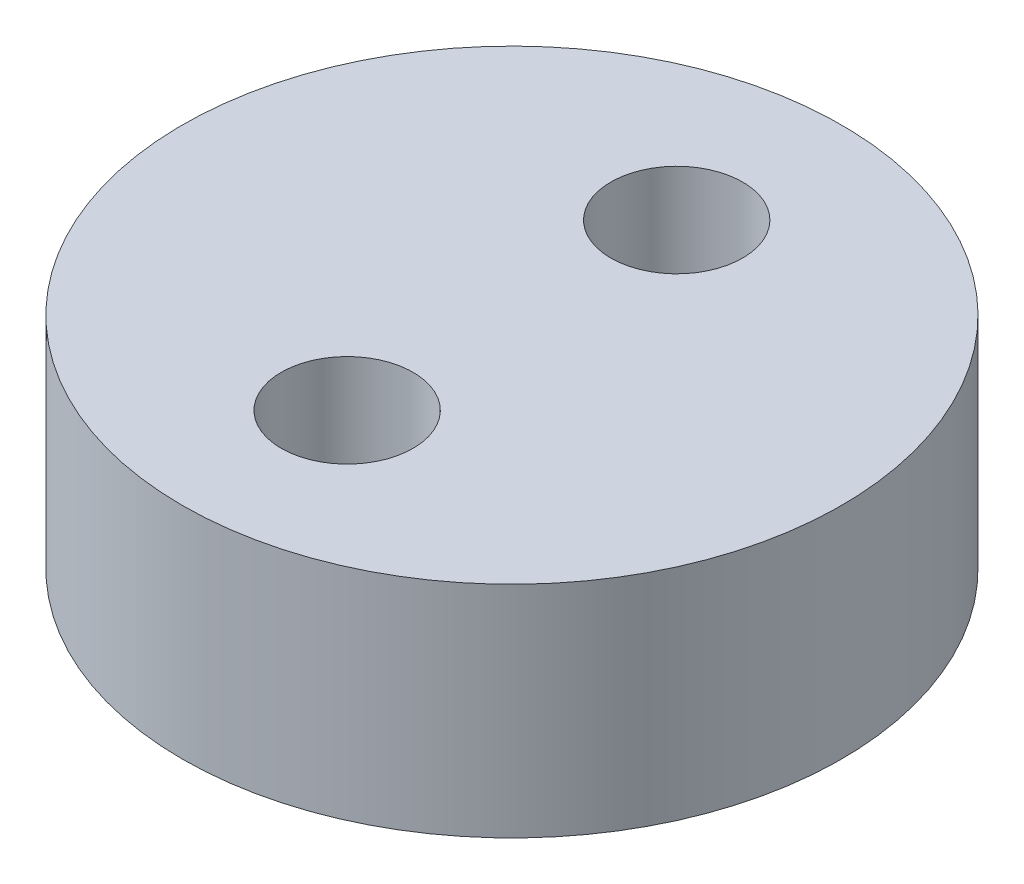
from build123d import *

# Parameters (mm, degrees)
SKETCH1_R           = 15
SKETCH1_R_2         = 3
BOSS_EXTRUDE1_DEPTH = 10


with BuildPart() as part:
    # Sketch1 → Boss-Extrude1 (new body)
    with BuildSketch(Plane(origin=(0, 0, 0), x_dir=(1, 0, 0), z_dir=(0, 1, 0))):
        with Locations(Location((0, 0, 0), (0, 0, 270))):
            Circle(SKETCH1_R)
        with Locations(Location((0, 7.5, 0), (0, 0, 270))):
            Circle(SKETCH1_R_2, mode=Mode.SUBTRACT)
        with Locations(Location((0, -7.5, 0), (0, 0, 270))):
            Circle(SKETCH1_R_2, mode=Mode.SUBTRACT)
    extrude(amount=BOSS_EXTRUDE1_DEPTH)


solid = part.part
